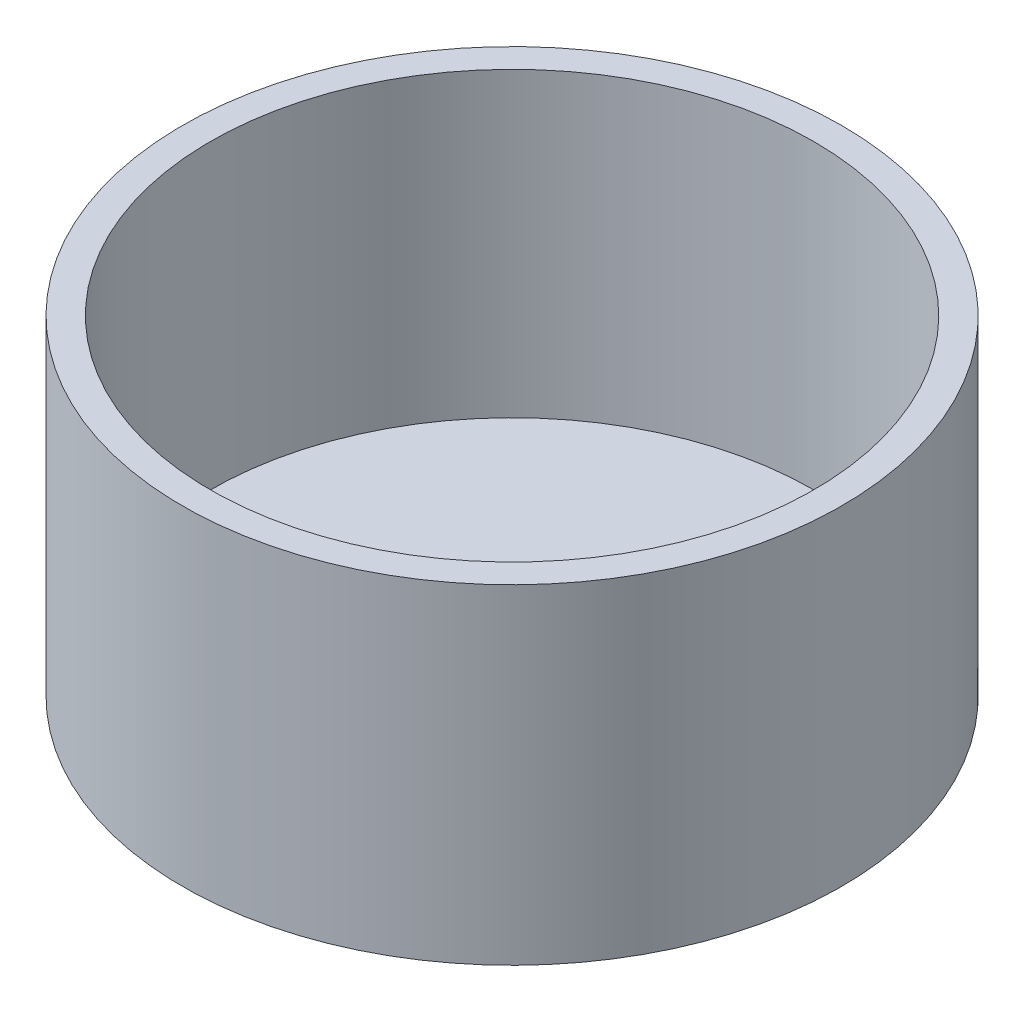
from build123d import *

# Parameters (mm, degrees)
SKETCH1_R           = 59.19
SKETCH1_R_2         = 54.19
BOSS_EXTRUDE2_DEPTH = 54.19
BOSS_EXTRUDE3_START = -5
SKETCH1_3_R         = 59.19
BOSS_EXTRUDE3_DEPTH = 5


with BuildPart() as part:
    # Sketch1 → Boss-Extrude2 (new body)
    with BuildSketch(Plane(origin=(0, 0, 0), x_dir=(1, 0, 0), z_dir=(0, 1, 0))):
        Circle(SKETCH1_R)
        Circle(SKETCH1_R_2, mode=Mode.SUBTRACT)
    extrude(amount=BOSS_EXTRUDE2_DEPTH)

    # Sketch1<3> → Boss-Extrude3 (add)
    with BuildSketch(Plane(origin=(0, 0, 0), x_dir=(1, 0, 0), z_dir=(0, 1, 0)).offset(BOSS_EXTRUDE3_START)):
        Circle(SKETCH1_3_R)
    extrude(amount=BOSS_EXTRUDE3_DEPTH)


solid = part.part
